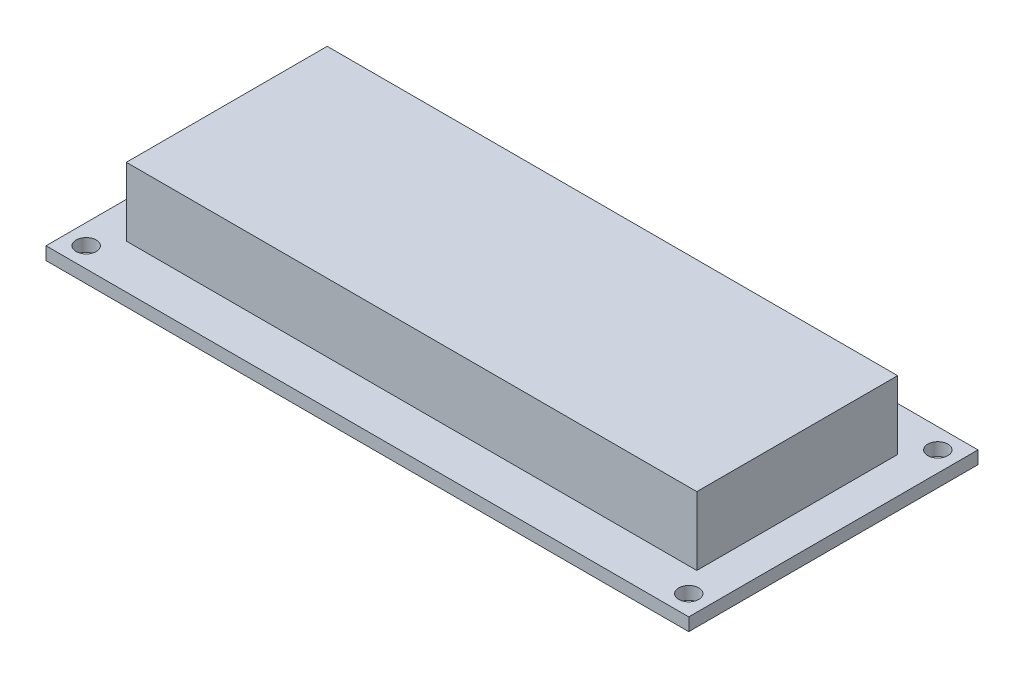
from build123d import *

# Parameters (mm, degrees)
SKETCH1_W           = 80
SKETCH1_H           = 36
BOSS_EXTRUDE1_DEPTH = 1.6
SKETCH2_R           = 1.25
CUT_EXTRUDE1_DEPTH  = 1.6
SKETCH3_W           = 71
SKETCH3_H           = 25
BOSS_EXTRUDE2_DEPTH = 8.5
SKETCH4_R           = 0.261136338
BOSS_EXTRUDE3_DEPTH = 0.1
LPATTERN1_COUNT     = 16
LPATTERN1_PITCH     = 2.54


with BuildPart() as part:
    # Sketch1 → Boss-Extrude1 (new body)
    with BuildSketch(Plane(origin=(0, 0, 0), x_dir=(1, 0, 0), z_dir=(0, 1, 0))):
        Rectangle(SKETCH1_W, SKETCH1_H)
    extrude(amount=BOSS_EXTRUDE1_DEPTH)

    # Sketch2 → Cut-Extrude1 (cut)
    with BuildSketch(Plane(origin=(0, 1.6, 0), x_dir=(1, 0, 0), z_dir=(0, 1, 0))):
        with Locations(Location((-37.5, 15.5, 0), (0, 0, 270))):
            Circle(SKETCH2_R)
        with Locations(Location((37.5, 15.5, 0), (0, 0, 270))):
            Circle(SKETCH2_R)
        with Locations(Location((37.5, -15.5, 0), (0, 0, 270))):
            Circle(SKETCH2_R)
        with Locations(Location((-37.5, -15.5, 0), (0, 0, 270))):
            Circle(SKETCH2_R)
    extrude(amount=-CUT_EXTRUDE1_DEPTH, mode=Mode.SUBTRACT)

    # Sketch3 → Boss-Extrude2 (add)
    with BuildSketch(Plane(origin=(0, 1.6, 0), x_dir=(1, 0, 0), z_dir=(0, 1, 0))):
        Rectangle(SKETCH3_W, SKETCH3_H)
    extrude(amount=BOSS_EXTRUDE2_DEPTH)

    # Sketch4 → Boss-Extrude3 (add)
    with BuildSketch(Plane(origin=(0, 1.6, 0), x_dir=(1, 0, 0), z_dir=(0, 1, 0))):
        with BuildLine():
            Line((-33, 16), (-33, 18))
            Line((-33, 18), (-31, 18))
            Line((-31, 18), (-31, 16))
            ThreePointArc((-31, 16), (-32, 15), (-33, 16))
        make_face()
        with Locations(Location((-32, 16, 0), (0, 0, 270))):
            Circle(SKETCH4_R, mode=Mode.SUBTRACT)
    boss_extrude3 = extrude(amount=BOSS_EXTRUDE3_DEPTH)

    # LPattern1: Boss-Extrude3 ×16
    with Locations(*[(i * LPATTERN1_PITCH, 0, 0) for i in range(1, LPATTERN1_COUNT)]):
        add(boss_extrude3)


solid = part.part
